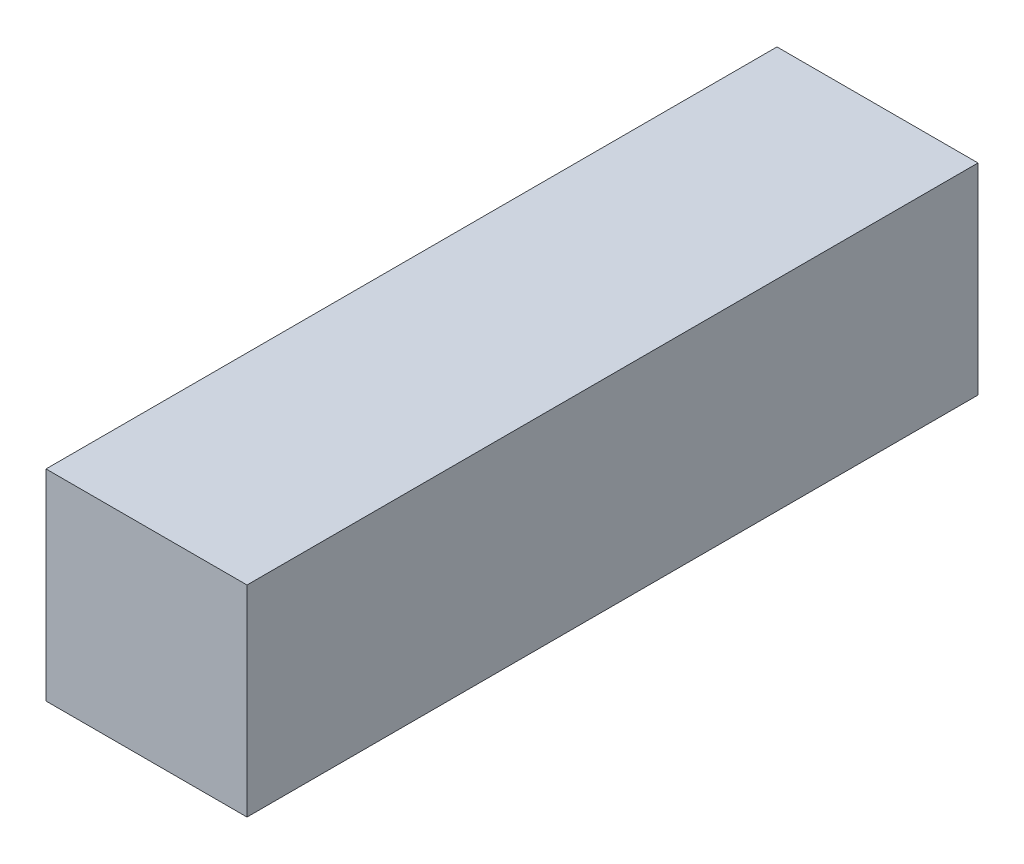
from build123d import *

# Parameters (mm, degrees)
ESQUISSE1_W        = 22
ESQUISSE1_H        = 22
BOSS_EXTRU_1_DEPTH = 80


with BuildPart() as part:
    # Esquisse1 → Boss.-Extru.1 (new body)
    with BuildSketch(Plane.XY):
        with Locations((11, -11)):
            Rectangle(ESQUISSE1_W, ESQUISSE1_H)
    extrude(amount=BOSS_EXTRU_1_DEPTH)


solid = part.part
